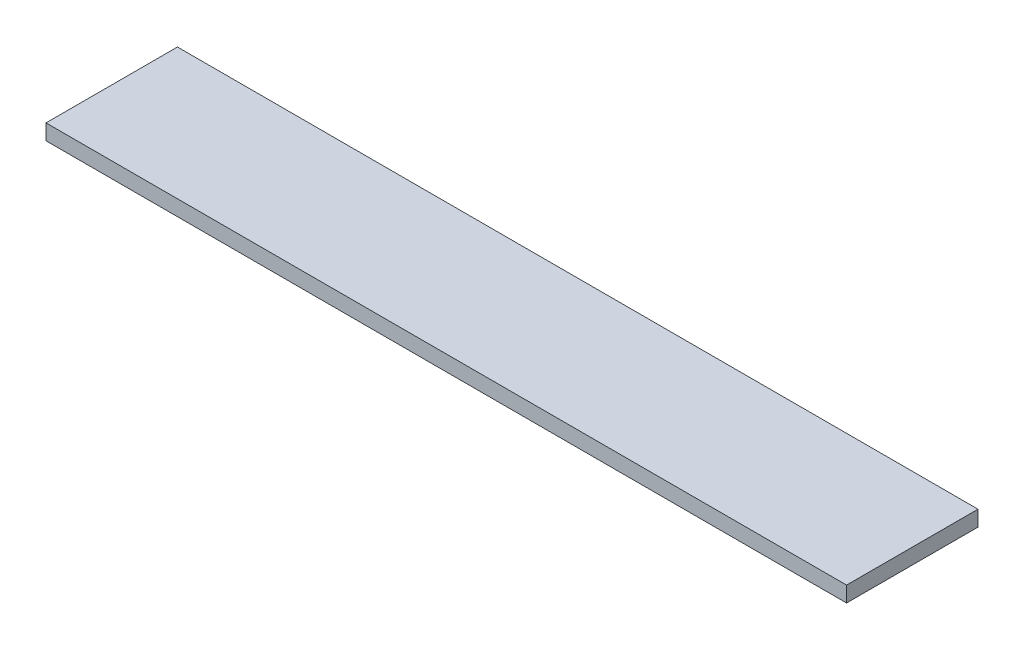
from build123d import *

# Parameters (mm, degrees)
SKETCH1_W           = 67
SKETCH1_H           = 11
BOSS_EXTRUDE1_DEPTH = 1.3


with BuildPart() as part:
    # Sketch1 → Boss-Extrude1 (new body)
    with BuildSketch(Plane(origin=(0, 0, 0), x_dir=(1, 0, 0), z_dir=(0, 1, 0))):
        with Locations((17.875, 2)):
            Rectangle(SKETCH1_W, SKETCH1_H)
    extrude(amount=BOSS_EXTRUDE1_DEPTH)


solid = part.part
